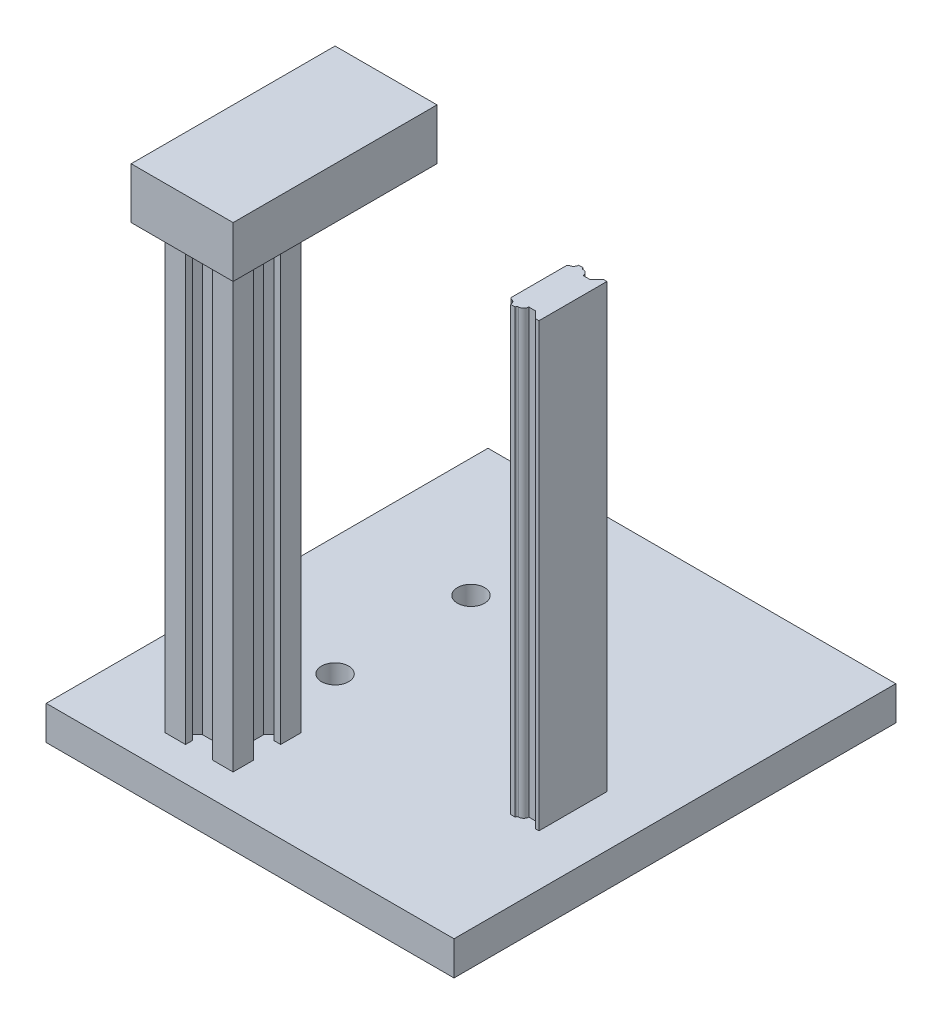
from build123d import *

# Parameters (mm, degrees)
SKETCH1_W           = 120
SKETCH1_H           = 130
BASEMOUNT_DEPTH     = 10
SKETCH4_W           = 10
SKETCH4_H           = 10
BOSS_EXTRUDE3_DEPTH = 130
CUT_EXTRUDE2_DEPTH  = 130
SKETCH6_R           = 4
CUT_EXTRUDE3_DEPTH  = 10
SKETCH7_W           = 20
SKETCH7_H           = 20
FRONTBAR_DEPTH      = 130
SKETCH8_W           = 8
SKETCH8_H           = 8
CENTERCUT_DEPTH     = 130
SITECUTBASIC_DEPTH  = 130
SITECUTMIRROR_COUNT = 4
SKETCH11_W          = 30
SKETCH11_H          = 60
UPPERBODY_DEPTH     = 15
CUT_EXTRUDE6_START  = -10
SKETCH13_R          = 4
CUT_EXTRUDE6_DEPTH  = 10


with BuildPart() as part:
    # Sketch1 → BaseMount (new body)
    with BuildSketch(Plane(origin=(0, 0, 0), x_dir=(1, 0, 0), z_dir=(0, 1, 0))):
        Rectangle(SKETCH1_W, SKETCH1_H)
    extrude(amount=BASEMOUNT_DEPTH)


with BuildPart() as body_2:
    # Sketch4 → Boss-Extrude3 (new body)
    with BuildSketch(Plane(origin=(0, 10, 0), x_dir=(1, 0, 0), z_dir=(0, 1, 0))):
        with Locations((40, -10)):
            Rectangle(SKETCH4_W, SKETCH4_H)
    boss_extrude3 = extrude(amount=BOSS_EXTRUDE3_DEPTH)

    # Sketch5 → Cut-Extrude2 (cut)
    with BuildSketch(Plane(origin=(0, 140, 0), x_dir=(1, 0, 0), z_dir=(0, 1, 0))):
        with BuildLine():
            Line((44, -5), (42, -7))
            Line((42, -7), (40, -7))
            ThreePointArc((40, -7), (39.560660172, -5.939339828), (38.5, -5.5))
            ThreePointArc((38.5, -5.5), (38.146446609, -5.353553391), (38, -5))
            Line((38, -5), (44, -5))
        make_face()
        with BuildLine():
            Line((35, -6.975723129), (35, -5))
            Line((35, -5), (36.689326349, -5))
            ThreePointArc((36.689326349, -5), (36.32939386, -5.974805658), (35.422331587, -6.481792347))
            ThreePointArc((35.422331587, -6.481792347), (35.119977497, -6.65078791), (35, -6.975723129))
        make_face()
        Polygon((45, 3.687489646), (44.5, 4.249082756), (44.5, 5.24232749), (45, 5.687489646), align=None)
    cut_extrude2 = extrude(amount=-CUT_EXTRUDE2_DEPTH, mode=Mode.SUBTRACT)


with BuildPart() as part_1:
    add(part.part)

    add(body_2.part)  # Mirror9 merges body 2
    # Mirror9: Boss-Extrude3 across plane
    add(boss_extrude3.mirror(Plane(origin=(45, 140, 15), x_dir=(1, 0, 0), z_dir=(0, 0, -1))))

    # Mirror9 2: Cut-Extrude2 across plane
    add(cut_extrude2.mirror(Plane(origin=(45, 140, 15), x_dir=(1, 0, 0), z_dir=(0, 0, -1))), mode=Mode.SUBTRACT)

    # Sketch6 → Cut-Extrude3 (cut)
    with BuildSketch(Plane(origin=(0, 10, 0), x_dir=(1, 0, 0), z_dir=(0, 1, 0))):
        with Locations((-25, -15)):
            Circle(SKETCH6_R)
        with Locations((-25, 25)):
            Circle(SKETCH6_R)
    extrude(amount=-CUT_EXTRUDE3_DEPTH, mode=Mode.SUBTRACT)

    # Sketch7 → frontBar (add)
    with BuildSketch(Plane(origin=(0, 10, 0), x_dir=(1, 0, 0), z_dir=(0, 1, 0))):
        with Locations((-25, -45)):
            Rectangle(SKETCH7_W, SKETCH7_H)
    extrude(amount=FRONTBAR_DEPTH)

    # Sketch8 → centercut (cut)
    with BuildSketch(Plane(origin=(0, 140, 0), x_dir=(1, 0, 0), z_dir=(0, 1, 0))):
        with Locations((-25, -45)):
            Rectangle(SKETCH8_W, SKETCH8_H)
    extrude(amount=-CENTERCUT_DEPTH, mode=Mode.SUBTRACT)

    # Sketch10 → siteCutBasic (cut)
    with BuildSketch(Plane(origin=(0, 140, 0), x_dir=(1, 0, 0), z_dir=(0, 1, 0))):
        Polygon((-32, -53), (-29, -53), (-29, -55), (-21, -55), (-21, -53), (-18, -53), (-21, -50), (-29, -50), align=None)
    sitecutbasic = extrude(amount=-SITECUTBASIC_DEPTH, mode=Mode.SUBTRACT)

    # siteCutMirror: siteCutBasic ×4 about axis
    sitecutmirror_axis = Axis((-25, 10, 45), (0, 1, 0))
    for i in range(1, SITECUTMIRROR_COUNT):
        add(sitecutbasic.rotate(sitecutmirror_axis, i * 360 / SITECUTMIRROR_COUNT), mode=Mode.SUBTRACT)

    # Sketch11 → upperBody (add)
    with BuildSketch(Plane(origin=(0, 140, 0), x_dir=(1, 0, 0), z_dir=(0, 1, 0))):
        with Locations((-25, -30)):
            Rectangle(SKETCH11_W, SKETCH11_H)
    extrude(amount=UPPERBODY_DEPTH)

    # Sketch13 → Cut-Extrude6 (cut)
    with BuildSketch(Plane.XZ.offset(-140).offset(CUT_EXTRUDE6_START)):
        with Locations((-25, 15)):
            Circle(SKETCH13_R)
    extrude(amount=CUT_EXTRUDE6_DEPTH, mode=Mode.SUBTRACT)


solid = part_1.part
